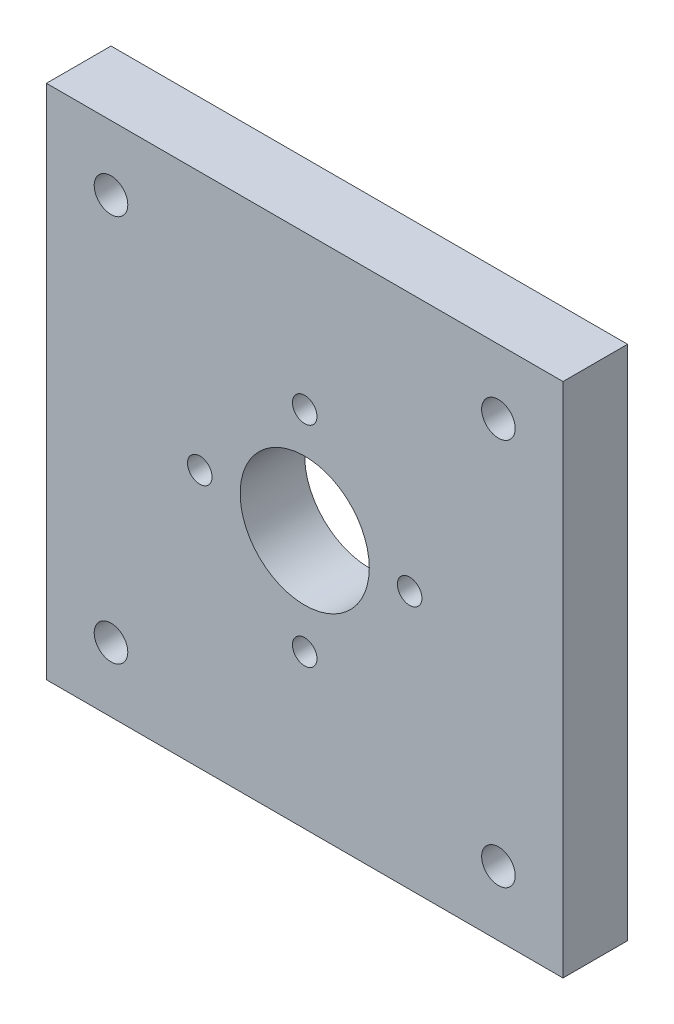
from build123d import *

# Parameters (mm, degrees)
SKETCH1_W           = 4
SKETCH1_H           = 4
SKETCH1_R           = 0.13
SKETCH1_R_2         = 0.5
SKETCH1_R_3         = 0.095
BOSS_EXTRUDE2_DEPTH = 0.25


with BuildPart() as part:
    # Sketch1 → Boss-Extrude2 (new, symmetric)
    with BuildSketch(Plane.XY):
        with Locations((0, -0.241413805)):
            Rectangle(SKETCH1_W, SKETCH1_H)
        with Locations((-1.5, 1.258586195)):
            Circle(SKETCH1_R, mode=Mode.SUBTRACT)
        with Locations((-1.5, -1.741413805)):
            Circle(SKETCH1_R, mode=Mode.SUBTRACT)
        with Locations(Location((1.5, -1.741413805, 0), (0, 0, 180))):
            Circle(SKETCH1_R, mode=Mode.SUBTRACT)
        with Locations(Location((1.5, 1.258586195, 0), (0, 0, 180))):
            Circle(SKETCH1_R, mode=Mode.SUBTRACT)
        with Locations((0, -0.241413805)):
            Circle(SKETCH1_R_2, mode=Mode.SUBTRACT)
        with Locations((0, 0.571086195)):
            Circle(SKETCH1_R_3, mode=Mode.SUBTRACT)
        with Locations((0.8125, -0.241413805)):
            Circle(SKETCH1_R_3, mode=Mode.SUBTRACT)
        with Locations((0, -1.053913805)):
            Circle(SKETCH1_R_3, mode=Mode.SUBTRACT)
        with Locations((-0.8125, -0.241413805)):
            Circle(SKETCH1_R_3, mode=Mode.SUBTRACT)
    extrude(amount=BOSS_EXTRUDE2_DEPTH, both=True)


solid = part.part
